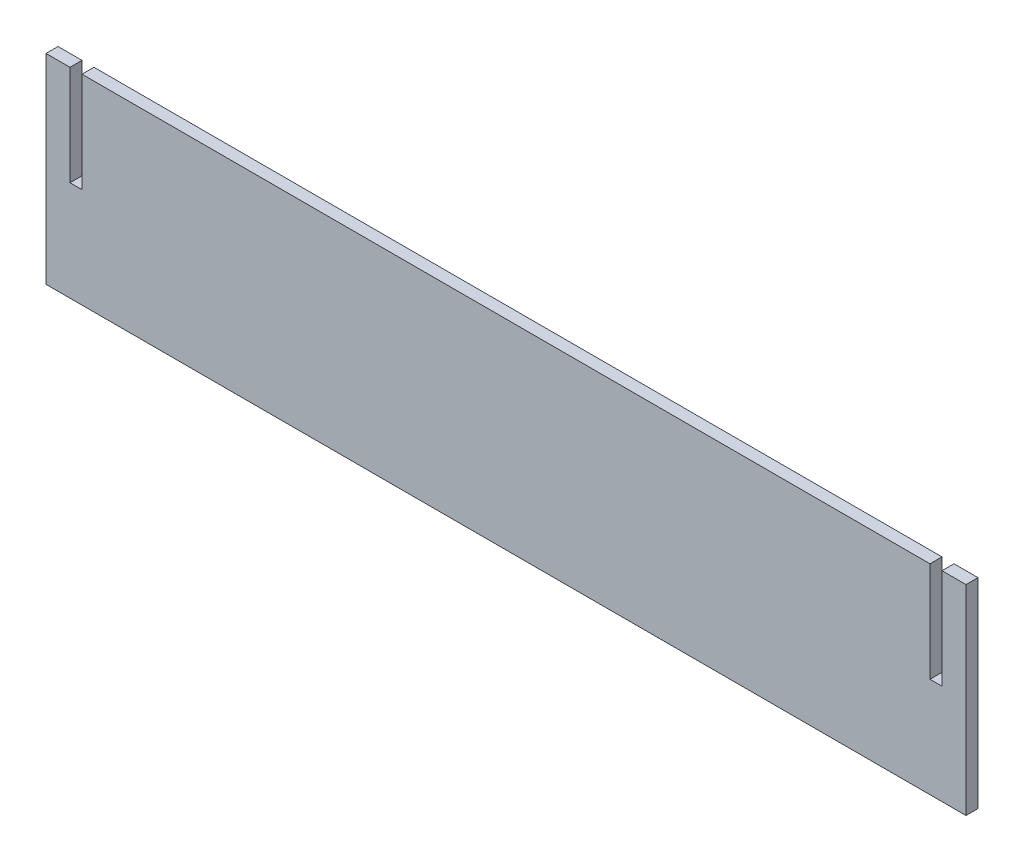
from build123d import *

# Parameters (mm, degrees)
BOSS_EXTRU_1_DEPTH = 3


with BuildPart() as part:
    # Esquisse1 → Boss.-Extru.1 (new body)
    with BuildSketch(Plane.XY):
        Polygon((-109, 25), (-109, 0), (-106, 0), (-106, 25), (106, 25), (106, 0), (109, 0), (109, 25), (115, 25), (115, -25), (-115, -25), (-115, 25), align=None)
    extrude(amount=BOSS_EXTRU_1_DEPTH)


solid = part.part
